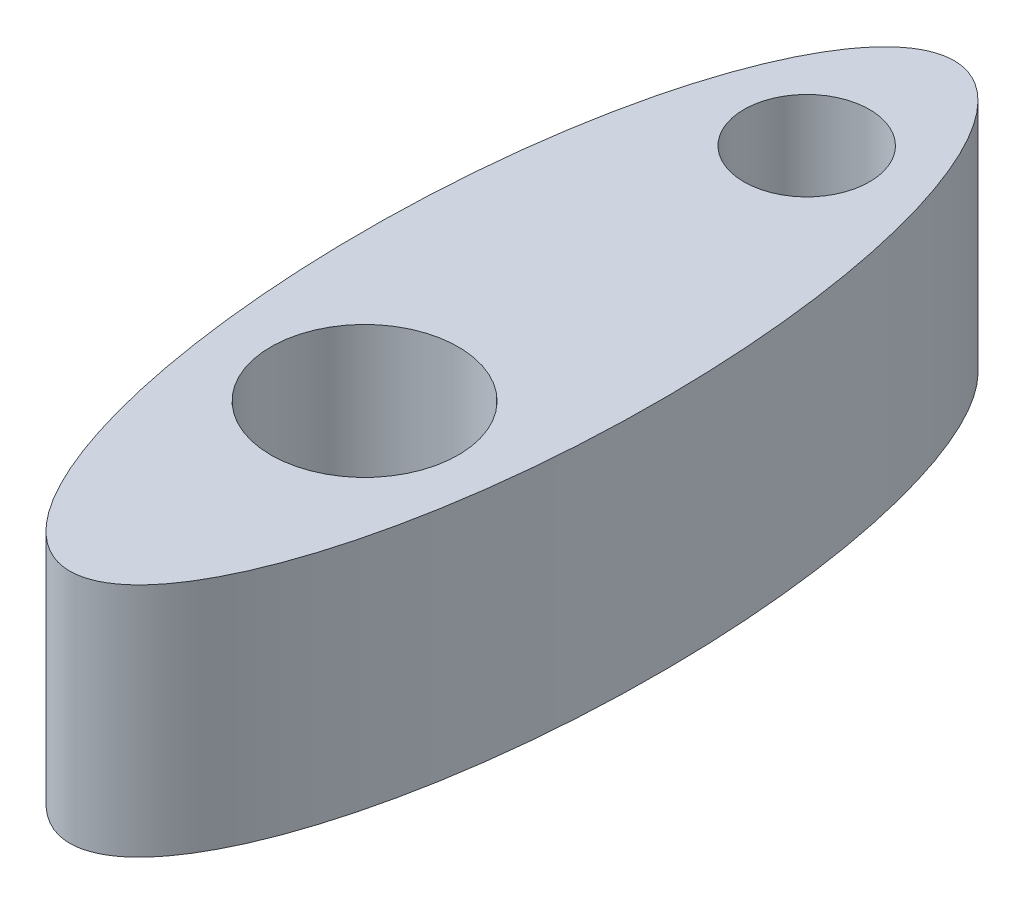
from build123d import *

# Parameters (mm, degrees)
SKETCH1_R              = 15.875
BOSS_EXTRUDE1_DEPTH    = 5.08
F_10_32_TAPPED_HOLE1_D = 4.0386
F_6_32_TAPPED_HOLE1_D  = 2.7051
SKETCH7_OUTSIDE_W      = 42.788
SKETCH7_OUTSIDE_H      = 42.788
SKETCH7_OUTSIDE_RX     = 9.525
SKETCH7_OUTSIDE_RY     = 3.175
CUT_EXTRUDE1_DEPTH     = 24.01820258


with BuildPart() as part:
    # Sketch1 → Boss-Extrude1 (new body)
    with BuildSketch(Plane(origin=(0, 0, 0), x_dir=(1, 0, 0), z_dir=(0, 1, 0))):
        with Locations(Location((0, 0, 0), (0, 0, 270))):
            Circle(SKETCH1_R)
    extrude(amount=BOSS_EXTRUDE1_DEPTH)

    # #10-32 Tapped Hole1 (through all)
    with Locations(Plane(origin=(0, 5.08, 0), x_dir=(1, 0, 0), z_dir=(0, 1, 0))):
        with Locations((0, 0)):
            Hole(F_10_32_TAPPED_HOLE1_D / 2)

    # #6-32 Tapped Hole1 (through all)
    with Locations(Plane(origin=(0, 5.08, 0), x_dir=(1, 0, 0), z_dir=(0, 1, 0))):
        with Locations((0, 9.525)):
            Hole(F_6_32_TAPPED_HOLE1_D / 2)

    # Sketch7 outside → Cut-Extrude1 (cut, through all)
    with BuildSketch(Plane(origin=(0, 5.08, 0), x_dir=(1, 0, 0), z_dir=(0, 1, 0))):
        Rectangle(SKETCH7_OUTSIDE_W, SKETCH7_OUTSIDE_H)
        with Locations(Location((0, 3.175), (0, 0, -90))):
            Ellipse(SKETCH7_OUTSIDE_RX, SKETCH7_OUTSIDE_RY, mode=Mode.SUBTRACT)
    extrude(amount=-CUT_EXTRUDE1_DEPTH, mode=Mode.SUBTRACT)


solid = part.part
